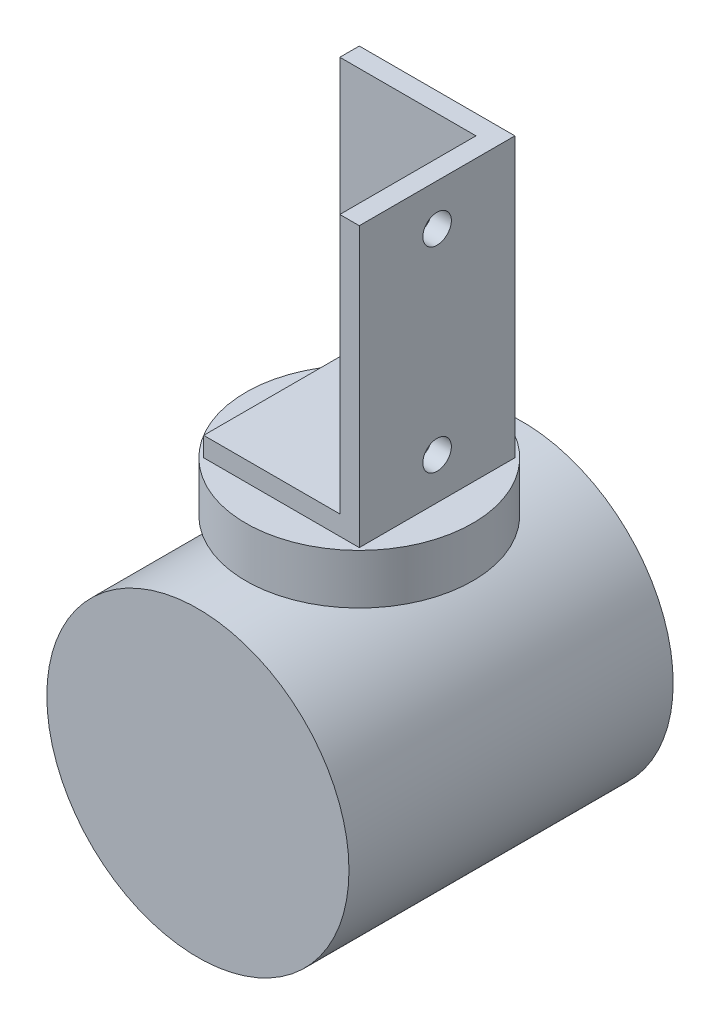
from build123d import *

# Parameters (mm, degrees)
SKETCH1_W           = 30.48
SKETCH1_H           = 30.48
BOSS_EXTRUDE1_DEPTH = 3.81
BOSS_EXTRUDE2_DEPTH = 50.8
SKETCH3_R           = 2.794
CUT_EXTRUDE1_DEPTH  = 3.81
SKETCH4_R           = 22.225
BOSS_EXTRUDE3_DEPTH = 9.779
SKETCH5_W           = 63.5
SKETCH5_H           = 29.591


with BuildPart() as part:
    # Sketch1 → Boss-Extrude1 (new body)
    with BuildSketch(Plane(origin=(0, 0, 0), x_dir=(1, 0, 0), z_dir=(0, 1, 0))):
        Rectangle(SKETCH1_W, SKETCH1_H)
    extrude(amount=BOSS_EXTRUDE1_DEPTH)

    # Sketch2 → Boss-Extrude2 (add)
    with BuildSketch(Plane(origin=(0, 3.81, 0), x_dir=(1, 0, 0), z_dir=(0, 1, 0))):
        Polygon((-15.24, 15.24), (11.43, 15.24), (15.24, 15.24), (15.24, 11.43), (15.24, -15.24), (11.43, -15.24), (11.43, 11.43), (-15.24, 11.43), align=None)
    extrude(amount=BOSS_EXTRUDE2_DEPTH)

    # Sketch3 → Cut-Extrude1 (cut)
    with BuildSketch(Plane(origin=(15.24, 0, 0), x_dir=(0, 0, -1), z_dir=(1, 0, 0))):
        with Locations((0, 46.482)):
            Circle(SKETCH3_R)
        with Locations((0, 8.128)):
            Circle(SKETCH3_R)
    extrude(amount=-CUT_EXTRUDE1_DEPTH, mode=Mode.SUBTRACT)

    # Sketch4 → Boss-Extrude3 (add)
    with BuildSketch(Plane.XZ):
        with Locations(Location((0, 0, 0), (0, 0, 270))):
            Circle(SKETCH4_R)
    extrude(amount=BOSS_EXTRUDE3_DEPTH)


with BuildPart() as body_2:
    # Sketch5 → Revolve1 (revolve)
    with BuildSketch(Plane.ZY, mode=Mode.PRIVATE) as revolve1_sk:
        with Locations((-0.140484246, -24.5745)):
            Rectangle(SKETCH5_W, SKETCH5_H)
    revolve(revolve1_sk.sketch.rotate(Axis((0, -39.37, -31.890484246), (0, 0, 1)), 90), axis=Axis((0, -39.37, -31.890484246), (0, 0, 1)))


solid = Compound([part.part, body_2.part])
